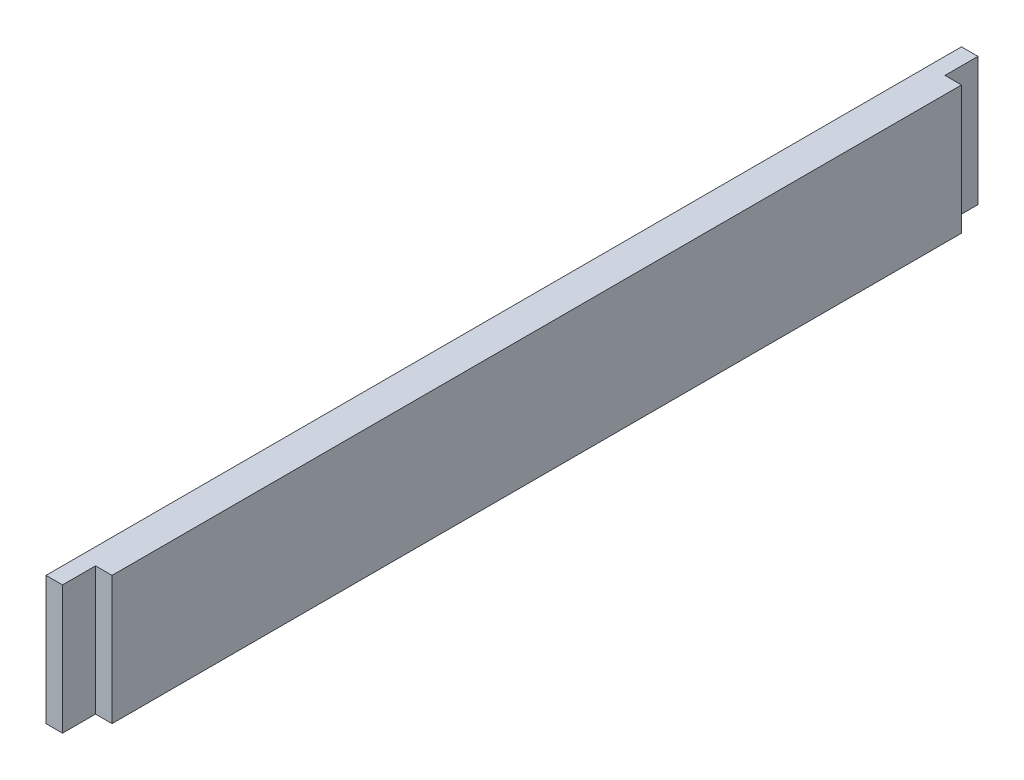
from build123d import *

# Parameters (mm, degrees)
SKETCH1_W           = 499
SKETCH1_H           = 70
BOSS_EXTRUDE1_DEPTH = 18
SKETCH2_W           = 18
SKETCH2_H           = 70
CUT_EXTRUDE1_DEPTH  = 9


with BuildPart() as part:
    # Sketch1 → Boss-Extrude1 (new body)
    with BuildSketch(Plane(origin=(0, 0, 0), x_dir=(0, 0, -1), z_dir=(1, 0, 0))):
        with Locations((249.5, 35)):
            Rectangle(SKETCH1_W, SKETCH1_H)
    extrude(amount=BOSS_EXTRUDE1_DEPTH)

    # Sketch2 → Cut-Extrude1 (cut)
    with BuildSketch(Plane(origin=(18, 0, 0), x_dir=(0, 0, -1), z_dir=(1, 0, 0))):
        with Locations((490, 35)):
            Rectangle(SKETCH2_W, SKETCH2_H)
        with Locations((9, 35)):
            Rectangle(SKETCH2_W, SKETCH2_H)
    extrude(amount=-CUT_EXTRUDE1_DEPTH, mode=Mode.SUBTRACT)


solid = part.part
